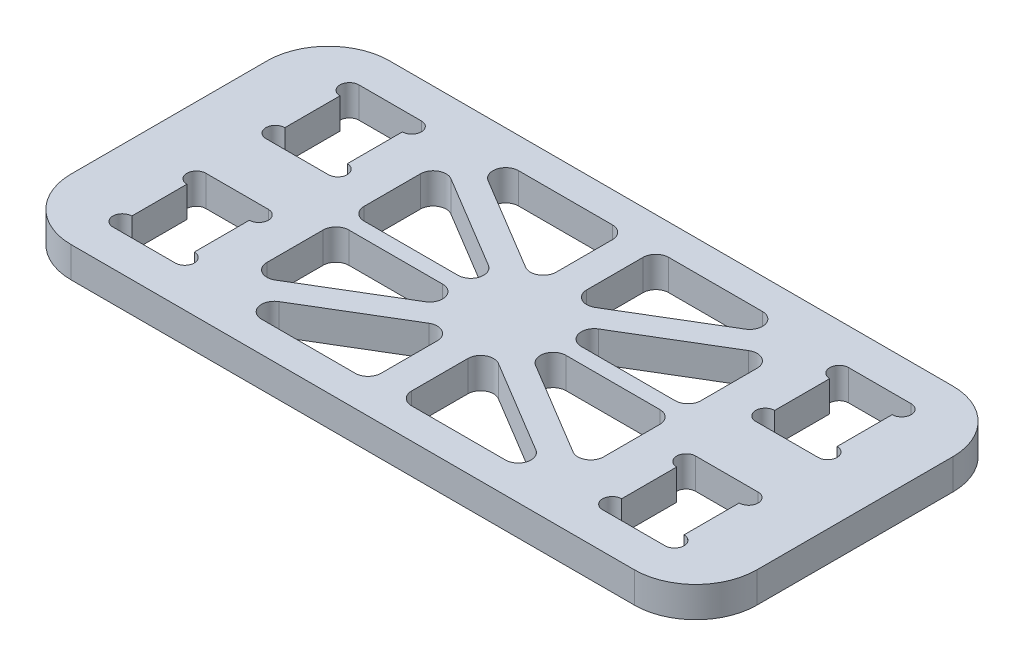
from build123d import *

# Parameters (mm, degrees)
SKETCH_1_W          = 112
SKETCH_1_H          = 52
SKETCH_1_W_2        = 10
SKETCH_1_H_2        = 15
EXTRUDE_1_DEPTH     = 5
MOVE_FACE_1_BY      = 0.1
MOVE_FACE_1_2_BY    = 0.1
MOVE_FACE_1_3_BY    = 0.1
MOVE_FACE_1_4_BY    = 0.1
MOVE_FACE_1_5_BY    = 0.1
MOVE_FACE_1_6_BY    = 0.1
MOVE_FACE_1_7_BY    = 0.1
MOVE_FACE_1_8_BY    = 0.1
MOVE_FACE_1_9_BY    = 0.1
MOVE_FACE_1_10_BY   = 0.1
MOVE_FACE_1_11_BY   = 0.1
MOVE_FACE_1_12_BY   = 0.1
MOVE_FACE_1_13_BY   = 0.1
MOVE_FACE_1_14_BY   = 0.1
MOVE_FACE_1_15_BY   = 0.1
MOVE_FACE_1_16_BY   = 0.1
SKETCH_2_R          = 1.55
CUT_EXTRUDE_1_DEPTH = 5
CUT_EXTRUDE_2_DEPTH = 5
FILLET_1_R          = 2.1
FILLET_2_R          = 10


with BuildPart() as part:
    # 草图1 → 凸台-拉伸1 (new body)
    with BuildSketch(Plane(origin=(0, 0, 0), x_dir=(1, 0, 0), z_dir=(0, 1, 0))):
        Rectangle(SKETCH_1_W, SKETCH_1_H)
        with Locations((40, -12.5)):
            Rectangle(SKETCH_1_W_2, SKETCH_1_H_2, mode=Mode.SUBTRACT)
        with Locations((40, 12.5)):
            Rectangle(SKETCH_1_W_2, SKETCH_1_H_2, mode=Mode.SUBTRACT)
        with Locations((-40, -12.5)):
            Rectangle(SKETCH_1_W_2, SKETCH_1_H_2, mode=Mode.SUBTRACT)
        with Locations((-40, 12.5)):
            Rectangle(SKETCH_1_W_2, SKETCH_1_H_2, mode=Mode.SUBTRACT)
    extrude(amount=EXTRUDE_1_DEPTH)

    # Move Face 1: a face moved inward by 0.1
    extrude(part.faces().sort_by_distance((-45, 2.5, -12.5))[0], amount=MOVE_FACE_1_BY, dir=(-1, 0, 0), mode=Mode.SUBTRACT)

    # Move Face 1 2: a face moved inward by 0.1
    extrude(part.faces().sort_by_distance((-40, 2.5, -20))[0], amount=MOVE_FACE_1_2_BY, dir=(0, 0, -1), mode=Mode.SUBTRACT)

    # Move Face 1 3: a face moved inward by 0.1
    extrude(part.faces().sort_by_distance((-45, 2.5, 12.5))[0], amount=MOVE_FACE_1_3_BY, dir=(-1, 0, 0), mode=Mode.SUBTRACT)

    # Move Face 1 4: a face moved inward by 0.1
    extrude(part.faces().sort_by_distance((-40, 2.5, 5))[0], amount=MOVE_FACE_1_4_BY, dir=(0, 0, -1), mode=Mode.SUBTRACT)

    # Move Face 1 5: a face moved inward by 0.1
    extrude(part.faces().sort_by_distance((-40, 2.5, 20))[0], amount=MOVE_FACE_1_5_BY, dir=(0, 0, 1), mode=Mode.SUBTRACT)

    # Move Face 1 6: a face moved inward by 0.1
    extrude(part.faces().sort_by_distance((-35, 2.5, 12.5))[0], amount=MOVE_FACE_1_6_BY, dir=(1, 0, 0), mode=Mode.SUBTRACT)

    # Move Face 1 7: a face moved inward by 0.1
    extrude(part.faces().sort_by_distance((-40, 2.5, -5))[0], amount=MOVE_FACE_1_7_BY, dir=(0, 0, 1), mode=Mode.SUBTRACT)

    # Move Face 1 8: a face moved inward by 0.1
    extrude(part.faces().sort_by_distance((-35, 2.5, -12.5))[0], amount=MOVE_FACE_1_8_BY, dir=(1, 0, 0), mode=Mode.SUBTRACT)

    # Move Face 1 9: a face moved inward by 0.1
    extrude(part.faces().sort_by_distance((40, 2.5, 20))[0], amount=MOVE_FACE_1_9_BY, dir=(0, 0, 1), mode=Mode.SUBTRACT)

    # Move Face 1 10: a face moved inward by 0.1
    extrude(part.faces().sort_by_distance((35, 2.5, 12.5))[0], amount=MOVE_FACE_1_10_BY, dir=(-1, 0, 0), mode=Mode.SUBTRACT)

    # Move Face 1 11: a face moved inward by 0.1
    extrude(part.faces().sort_by_distance((45, 2.5, 12.5))[0], amount=MOVE_FACE_1_11_BY, dir=(1, 0, 0), mode=Mode.SUBTRACT)

    # Move Face 1 12: a face moved inward by 0.1
    extrude(part.faces().sort_by_distance((40, 2.5, 5))[0], amount=MOVE_FACE_1_12_BY, dir=(0, 0, -1), mode=Mode.SUBTRACT)

    # Move Face 1 13: a face moved inward by 0.1
    extrude(part.faces().sort_by_distance((40, 2.5, -5))[0], amount=MOVE_FACE_1_13_BY, dir=(0, 0, 1), mode=Mode.SUBTRACT)

    # Move Face 1 14: a face moved inward by 0.1
    extrude(part.faces().sort_by_distance((35, 2.5, -12.5))[0], amount=MOVE_FACE_1_14_BY, dir=(-1, 0, 0), mode=Mode.SUBTRACT)

    # Move Face 1 15: a face moved inward by 0.1
    extrude(part.faces().sort_by_distance((40, 2.5, -20))[0], amount=MOVE_FACE_1_15_BY, dir=(0, 0, -1), mode=Mode.SUBTRACT)

    # Move Face 1 16: a face moved inward by 0.1
    extrude(part.faces().sort_by_distance((45, 2.5, -12.5))[0], amount=MOVE_FACE_1_16_BY, dir=(1, 0, 0), mode=Mode.SUBTRACT)

    # 草图2 → 切除-拉伸1 (cut)
    with BuildSketch(Plane(origin=(0, 5, 0), x_dir=(1, 0, 0), z_dir=(0, 1, 0))):
        with Locations((45.1, 18.55)):
            Circle(SKETCH_2_R)
        with Locations((45.1, 6.45)):
            Circle(SKETCH_2_R)
        with Locations((45.1, -6.45)):
            Circle(SKETCH_2_R)
        with Locations((45.1, -18.55)):
            Circle(SKETCH_2_R)
        with Locations((34.9, -18.55)):
            Circle(SKETCH_2_R)
        with Locations((34.9, -6.45)):
            Circle(SKETCH_2_R)
        with Locations((34.9, 6.45)):
            Circle(SKETCH_2_R)
        with Locations((34.9, 18.55)):
            Circle(SKETCH_2_R)
        with Locations((-34.9, 18.55)):
            Circle(SKETCH_2_R)
        with Locations((-34.9, 6.45)):
            Circle(SKETCH_2_R)
        with Locations((-34.9, -6.45)):
            Circle(SKETCH_2_R)
        with Locations((-34.9, -18.55)):
            Circle(SKETCH_2_R)
        with Locations((-45.1, -18.55)):
            Circle(SKETCH_2_R)
        with Locations((-45.1, -6.45)):
            Circle(SKETCH_2_R)
        with Locations((-45.1, 6.45)):
            Circle(SKETCH_2_R)
        with Locations((-45.1, 18.55)):
            Circle(SKETCH_2_R)
    extrude(amount=-CUT_EXTRUDE_1_DEPTH, mode=Mode.SUBTRACT)

    # 草图3 → 切除-拉伸2 (cut)
    with BuildSketch(Plane(origin=(0, 5, 0), x_dir=(1, 0, 0), z_dir=(0, 1, 0))):
        Polygon((2.5, 21), (27.5, 21), (2.5, 6), align=None)
        Polygon((27.5, 16.25), (2.5, 1.25), (27.5, 1.25), align=None)
        Polygon((-2.5, 1.25), (-27.5, 1.25), (-27.5, 16.25), align=None)
        Polygon((-27.5, 21), (-2.5, 6), (-2.5, 21), align=None)
        Polygon((2.5, -1.25), (27.5, -1.25), (27.5, -16.25), align=None)
        Polygon((27.5, -21), (2.5, -6), (2.5, -21), align=None)
        Polygon((-27.5, -1.25), (-27.5, -16.25), (-2.5, -1.25), align=None)
        Polygon((-2.5, -21), (-27.5, -21), (-2.5, -6), align=None)
    extrude(amount=-CUT_EXTRUDE_2_DEPTH, mode=Mode.SUBTRACT)

    # 圆角1
    fillet_1_edges = [part.edges().sort_by_distance(p)[0] for p in [
        (27.5, 2.5, 16.25),
        (2.5, 2.5, 1.25),
        (27.5, 2.5, 1.25),
        (-27.5, 2.5, -21),
        (-2.5, 2.5, -21),
        (-2.5, 2.5, -6),
        (-27.5, 2.5, -16.25),
        (-2.5, 2.5, -1.25),
        (-27.5, 2.5, -1.25),
        (27.5, 2.5, -16.25),
        (27.5, 2.5, -1.25),
        (2.5, 2.5, -1.25),
        (-2.5, 2.5, 6),
        (-2.5, 2.5, 21),
        (-27.5, 2.5, 21),
        (-27.5, 2.5, 1.25),
        (-2.5, 2.5, 1.25),
        (-27.5, 2.5, 16.25),
        (27.5, 2.5, 21),
        (2.5, 2.5, 21),
        (2.5, 2.5, 6),
        (2.5, 2.5, -6),
        (2.5, 2.5, -21),
        (27.5, 2.5, -21),
    ]]
    fillet(fillet_1_edges, radius=FILLET_1_R)

    # 圆角2
    fillet_2_edges = [part.edges().sort_by_distance(p)[0] for p in [
        (-56, 2.5, -26),
        (56, 2.5, -26),
        (56, 2.5, 26),
        (-56, 2.5, 26),
    ]]
    fillet(fillet_2_edges, radius=FILLET_2_R)


solid = part.part
